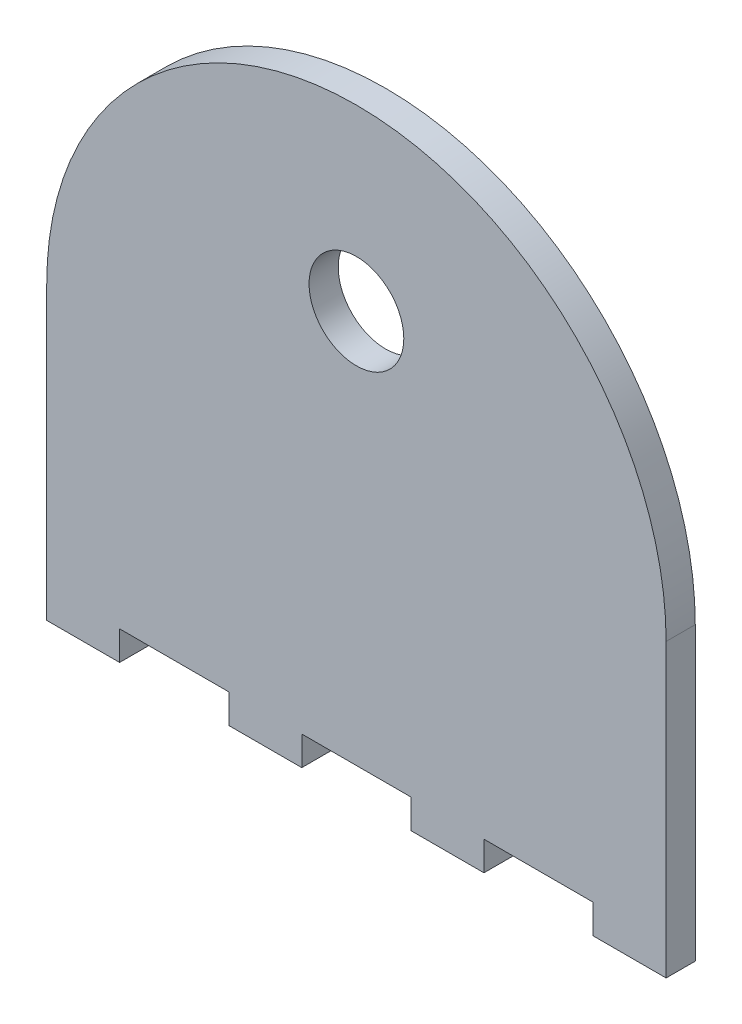
from build123d import *

# Parameters (mm, degrees)
SALIENTE_EXTRUIR1_DEPTH = 4
CROQUIS2_R              = 6.5
CORTAR_EXTRUIR1_DEPTH   = 4


with BuildPart() as part:
    # Croquis1 → Saliente-Extruir1 (new body)
    with BuildSketch(Plane.XY):
        with BuildLine():
            Line((0, 0), (10, 0))
            Line((10, 0), (10, 4))
            Line((10, 4), (25, 4))
            Line((25, 4), (25, 0))
            Line((25, 0), (35, 0))
            Line((35, 0), (35, 4))
            Line((35, 4), (50, 4))
            Line((50, 4), (50, 0))
            Line((50, 0), (60, 0))
            Line((60, 0), (60, 4))
            Line((60, 4), (75, 4))
            Line((75, 4), (75, 0))
            Line((75, 0), (85, 0))
            Line((85, 0), (85, 40))
            ThreePointArc((85, 40), (42.5, 82.5), (0, 40))
            Line((0, 40), (0, 0))
        make_face()
    extrude(amount=SALIENTE_EXTRUIR1_DEPTH)

    # Croquis2 → Cortar-Extruir1 (cut)
    with BuildSketch(Plane.XY.offset(4)):
        with Locations((42.5, 58)):
            Circle(CROQUIS2_R)
    extrude(amount=-CORTAR_EXTRUIR1_DEPTH, mode=Mode.SUBTRACT)


solid = part.part
